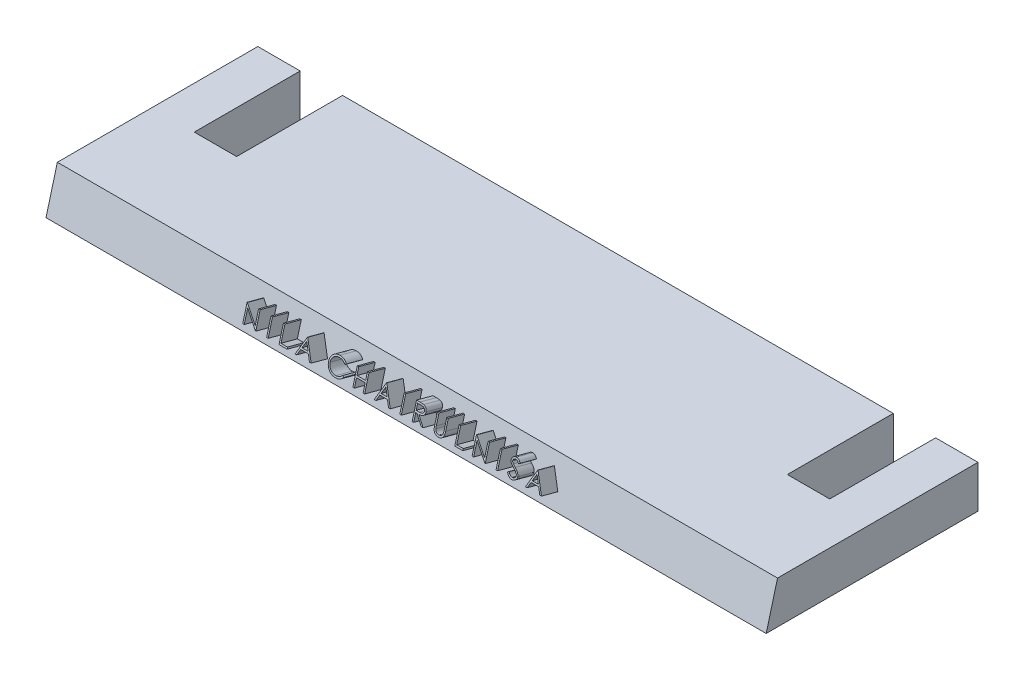
from build123d import *

# Parameters (mm, degrees)
BOSS_EXTRUDE1_DEPTH = 10
DRAFT1_ANGLE        = -15
SKETCH2_W           = 0.358974359
SKETCH2_H           = 4
BOSS_EXTRUDE2_DEPTH = 4


with BuildPart() as part:
    # Sketch1 → Boss-Extrude1 (new body)
    with BuildSketch(Plane(origin=(0, 0, 0), x_dir=(1, 0, 0), z_dir=(0, 1, 0))):
        Polygon((-75, 25), (-75, 0), (-65, 0), (-65, 25), (65, 25), (65, 0), (75, 0), (75, 25), (85, 25), (85, -25), (-85, -25), (-85, 25), align=None)
    extrude(amount=BOSS_EXTRUDE1_DEPTH)

    # Draft1
    draft1_faces = [part.faces().sort_by_distance(p)[0] for p in [
        (0, 5, 25),
    ]]
    draft(draft1_faces, Plane(origin=(0, 0, 0), x_dir=(0, 0, -1), z_dir=(0, -1, 0)), DRAFT1_ANGLE)

    # Sketch2 → Boss-Extrude2 (add)
    # profile 1 of 15: a face of its own
    with BuildSketch(Plane(origin=(0, 6.25, 23.325317547), x_dir=(1, 0, 0), z_dir=(0, 0.2588190451025213, 0.9659258262890681))):
        Polygon((-35.625650533, -2.888228707), (-35.625650533, 1.111771293), (-35.55033002, 1.111771293), (-32.907701815, -2.036465887), (-32.907701815, 1.111771293), (-32.548727456, 1.111771293), (-32.548727456, -2.888228707), (-32.630458225, -2.888228707), (-35.266676174, 0.252796934), (-35.266676174, -2.888228707), align=None)
    # profile 2 of 15: a face of its own
    with BuildSketch(Plane(origin=(0, 6.25, 23.325317547), x_dir=(1, 0, 0), z_dir=(0, 0.2588190451025213, 0.9659258262890681))):
        with Locations((-29.805137713, -0.888228707)):
            Rectangle(SKETCH2_W, SKETCH2_H)
    # profile 3 of 15: a face of its own
    with BuildSketch(Plane(origin=(0, 6.25, 23.325317547), x_dir=(1, 0, 0), z_dir=(0, 0.2588190451025213, 0.9659258262890681))):
        Polygon((-27.061547969, 1.111771293), (-26.70257361, 1.111771293), (-26.70257361, -2.477972297), (-25.164112072, -2.477972297), (-25.164112072, -2.888228707), (-27.061547969, -2.888228707), align=None)
    # profile 4 of 15: a face of its own
    with BuildSketch(Plane(origin=(0, 6.25, 23.325317547), x_dir=(1, 0, 0), z_dir=(0, 0.2588190451025213, 0.9659258262890681))):
        Polygon((-21.317958225, 1.111771293), (-19.471804379, -2.888228707), (-19.862028738, -2.888228707), (-20.453374892, -1.606177425), (-22.266676174, -1.606177425), (-22.874849251, -2.888228707), (-23.266676174, -2.888228707), (-21.369240277, 1.111771293), align=None)
        Polygon((-21.347605661, 0.332123857), (-22.071964636, -1.195921015), (-20.642477456, -1.195921015), align=None, mode=Mode.SUBTRACT)
    # profile 5 of 15: a face of its own
    with BuildSketch(Plane(origin=(0, 6.25, 23.325317547), x_dir=(1, 0, 0), z_dir=(0, 0.2588190451025213, 0.9659258262890681))):
        with BuildLine():
            Line((-11.984624892, 0.377796934), (-12.298727456, 0.137412319))
            add(Edge.make_bspline(
                [(-12.298727456, 0.137412319), (-12.321134186, 0.164116284), (-12.365645553, 0.217164188), (-12.437256071, 0.291655096), (-12.51188652, 0.361443966), (-12.589508372, 0.426863257), (-12.671518795, 0.485625275), (-12.755931136, 0.54079225), (-12.844157473, 0.590241093), (-12.966159456, 0.650198792), (-13.125756997, 0.712765826), (-13.326665384, 0.765226662), (-13.536392354, 0.798622291), (-13.679475325, 0.802239253), (-13.752253097, 0.804078985)],
                knots=[0, 0, 0, 0, 0.757959112, 1.505699292, 2.245454638, 2.979532153, 3.711538275, 4.438200793, 5.171680507, 5.909471876, 7.393775596, 8.890124382, 10.418191784, 12, 12, 12, 12], degree=3))
            add(Edge.make_bspline(
                [(-13.752253097, 0.804078985), (-13.792348296, 0.803617314), (-13.872166574, 0.802698256), (-13.990621972, 0.790573541), (-14.106865459, 0.773532158), (-14.22082142, 0.748246075), (-14.332344802, 0.716277367), (-14.44216469, 0.678076894), (-14.548691089, 0.63081422), (-14.653397647, 0.578576209), (-14.753716746, 0.519573415), (-14.8486368, 0.455215298), (-14.937811621, 0.386222045), (-15.021311749, 0.312335066), (-15.099222547, 0.233887111), (-15.170979474, 0.15004215), (-15.236334228, 0.061068237), (-15.296582257, -0.031861372), (-15.350539666, -0.128475991), (-15.395716671, -0.229133214), (-15.435722525, -0.332109332), (-15.467378803, -0.438567801), (-15.492435393, -0.547759534), (-15.509724151, -0.659977577), (-15.521710976, -0.774987497), (-15.522625463, -0.852940997), (-15.52308643, -0.892235117)],
                knots=[0, 0, 0, 0, 1.054917814, 2.100044995, 3.131103042, 4.146048494, 5.169673617, 6.183595914, 7.203665975, 8.234915748, 9.262203917, 10.264457458, 11.251630812, 12.227803204, 13.197192746, 14.159520551, 15.12972552, 16.100847026, 17.073214652, 18.039054194, 19.002613845, 19.979014051, 20.95965708, 21.949030935, 22.966165397, 24, 24, 24, 24], degree=3))
            add(Edge.make_bspline(
                [(-15.52308643, -0.892235117), (-15.521644352, -0.951356626), (-15.518813021, -1.067433866), (-15.493614925, -1.23745742), (-15.455323392, -1.400338191), (-15.397934161, -1.55505801), (-15.327169532, -1.703524705), (-15.23775169, -1.843226252), (-15.134189933, -1.976273754), (-15.015019168, -2.099522837), (-14.884269664, -2.212109952), (-14.743986337, -2.311253474), (-14.594518579, -2.393899054), (-14.437516716, -2.462671564), (-14.271772586, -2.515536396), (-14.09758424, -2.552752537), (-13.915330531, -2.577029315), (-13.790794074, -2.579353529), (-13.727413354, -2.580536399)],
                knots=[0, 0, 0, 0, 1.029171465, 2.020641659, 2.987623507, 3.938342917, 4.889210282, 5.84687017, 6.821220943, 7.821438502, 8.827599549, 9.822697543, 10.807740252, 11.797342354, 12.80366471, 13.83203677, 14.896651826, 16, 16, 16, 16], degree=3))
            add(Edge.make_bspline(
                [(-13.727413354, -2.580536399), (-13.657581709, -2.578606365), (-13.520136327, -2.574807597), (-13.318572869, -2.542625598), (-13.125617708, -2.49044512), (-12.941260466, -2.417418923), (-12.766020871, -2.322487166), (-12.599624687, -2.207403877), (-12.441931464, -2.071074354), (-12.347107141, -1.96697935), (-12.298727456, -1.913869733)],
                knots=[0, 0, 0, 0, 1.028121516, 2.023589091, 2.998037872, 3.967518031, 4.937445131, 5.927275754, 6.942489185, 8, 8, 8, 8], degree=3))
            Line((-12.298727456, -1.913869733), (-11.984624892, -2.151850502))
            add(Edge.make_bspline(
                [(-11.984624892, -2.151850502), (-12.009902732, -2.184465876), (-12.060337332, -2.249540397), (-12.142003637, -2.341279494), (-12.228034834, -2.42756982), (-12.319069932, -2.507715673), (-12.414061693, -2.583320776), (-12.514715765, -2.652237155), (-12.619708945, -2.715426737), (-12.728685492, -2.773286079), (-12.841529621, -2.824620076), (-12.958106118, -2.868567239), (-13.07791249, -2.906424256), (-13.200954214, -2.937569326), (-13.327486507, -2.961879136), (-13.457052763, -2.978130193), (-13.589932621, -2.98926381), (-13.679579959, -2.990278571), (-13.725009507, -2.99079281)],
                knots=[0, 0, 0, 0, 0.986787822, 1.968848986, 2.935600012, 3.899624008, 4.868462664, 5.837806735, 6.815139263, 7.798259679, 8.787526145, 9.778297419, 10.776456485, 11.791383307, 12.812564526, 13.85620153, 14.913611965, 16, 16, 16, 16], degree=3))
            add(Edge.make_bspline(
                [(-13.725009507, -2.99079281), (-13.768030841, -2.99049339), (-13.853100201, -2.989901323), (-13.978698775, -2.980310275), (-14.100972581, -2.967224861), (-14.219572154, -2.947521854), (-14.335144697, -2.92427118), (-14.446642507, -2.89310403), (-14.555162748, -2.858190696), (-14.660269423, -2.817156426), (-14.762051937, -2.770852217), (-14.860182007, -2.718519007), (-14.954614501, -2.660596876), (-15.046277839, -2.598362578), (-15.133817935, -2.529817091), (-15.217993393, -2.455912365), (-15.299276223, -2.376897496), (-15.349565005, -2.319920521), (-15.374849251, -2.291273579)],
                knots=[0, 0, 0, 0, 1.114604814, 2.203992996, 3.262667896, 4.300477797, 5.318619304, 6.316056647, 7.298880507, 8.271930387, 9.238335007, 10.195173496, 11.151986948, 12.108099108, 13.064862484, 14.031167946, 15.010108607, 16, 16, 16, 16], degree=3))
            add(Edge.make_bspline(
                [(-15.374849251, -2.291273579), (-15.415347129, -2.24151222), (-15.49585396, -2.142590265), (-15.598854741, -1.98226343), (-15.687023376, -1.814871191), (-15.758310142, -1.639534129), (-15.81403898, -1.456645687), (-15.85264606, -1.26611367), (-15.877733608, -1.068116022), (-15.88060251, -0.933445407), (-15.882060789, -0.864991528)],
                knots=[0, 0, 0, 0, 0.994628077, 1.977248131, 2.950237994, 3.925870899, 4.908910175, 5.911660606, 6.938484602, 8, 8, 8, 8], degree=3))
            add(Edge.make_bspline(
                [(-15.882060789, -0.864991528), (-15.880283425, -0.793042438), (-15.876786573, -0.651487095), (-15.847077092, -0.443745435), (-15.799284182, -0.244715264), (-15.731402024, -0.054768128), (-15.645338765, 0.12709505), (-15.539022635, 0.299484998), (-15.413688758, 0.463504198), (-15.270320109, 0.616663913), (-15.113100298, 0.756708888), (-14.944735939, 0.879915978), (-14.765556571, 0.982450282), (-14.577536169, 1.068160182), (-14.379266819, 1.134039568), (-14.17117154, 1.180157496), (-13.953641351, 1.208862772), (-13.805227151, 1.212491581), (-13.7298172, 1.214335396)],
                knots=[0, 0, 0, 0, 1.032925535, 2.032216505, 3.007276963, 3.968222605, 4.92396291, 5.891752235, 6.871517503, 7.883894988, 8.900124299, 9.891468569, 10.874487609, 11.85992873, 12.854644235, 13.869047385, 14.917252991, 16, 16, 16, 16], degree=3))
            add(Edge.make_bspline(
                [(-13.7298172, 1.214335396), (-13.683857803, 1.21378438), (-13.592885806, 1.212693702), (-13.458311346, 1.202058111), (-13.327291544, 1.184328275), (-13.199736136, 1.160195624), (-13.075024575, 1.130244399), (-12.954110014, 1.091226915), (-12.836282943, 1.046613737), (-12.722286477, 0.995232633), (-12.612667562, 0.937556357), (-12.507460341, 0.874224216), (-12.407500502, 0.805314724), (-12.312084676, 0.731413952), (-12.222809006, 0.650958456), (-12.137138745, 0.566161203), (-12.057983227, 0.47457969), (-12.009122433, 0.410116908), (-11.984624892, 0.377796934)],
                knots=[0, 0, 0, 0, 1.096760587, 2.17092713, 3.219439832, 4.250915756, 5.268269357, 6.278326846, 7.281116186, 8.274029601, 9.260640565, 10.235837813, 11.203064059, 12.156899882, 13.114053108, 14.069676657, 15.032185724, 16, 16, 16, 16], degree=3))
        make_face()
    # profile 6 of 15: a face of its own
    with BuildSketch(Plane(origin=(0, 6.25, 23.325317547), x_dir=(1, 0, 0), z_dir=(0, 0.2588190451025213, 0.9659258262890681))):
        Polygon((-9.625650533, 1.111771293), (-9.266676174, 1.111771293), (-9.266676174, -0.529254348), (-7.215394123, -0.529254348), (-7.215394123, 1.111771293), (-6.856419764, 1.111771293), (-6.856419764, -2.888228707), (-7.215394123, -2.888228707), (-7.215394123, -0.939510758), (-9.266676174, -0.939510758), (-9.266676174, -2.888228707), (-9.625650533, -2.888228707), align=None)
    # profile 7 of 15: a face of its own
    with BuildSketch(Plane(origin=(0, 6.25, 23.325317547), x_dir=(1, 0, 0), z_dir=(0, 0.2588190451025213, 0.9659258262890681))):
        Polygon((-2.651291559, 1.111771293), (-0.805137713, -2.888228707), (-1.195362072, -2.888228707), (-1.786708225, -1.606177425), (-3.600009507, -1.606177425), (-4.208182584, -2.888228707), (-4.600009507, -2.888228707), (-2.70257361, 1.111771293), align=None)
        Polygon((-2.680938995, 0.332123857), (-3.405297969, -1.195921015), (-1.975810789, -1.195921015), align=None, mode=Mode.SUBTRACT)
    # profile 8 of 15: a face of its own
    with BuildSketch(Plane(origin=(0, 6.25, 23.325317547), x_dir=(1, 0, 0), z_dir=(0, 0.2588190451025213, 0.9659258262890681))):
        with Locations((1.630759724, -0.888228707)):
            Rectangle(SKETCH2_W, SKETCH2_H)
    # profile 9 of 15: a face of its own
    with BuildSketch(Plane(origin=(0, 6.25, 23.325317547), x_dir=(1, 0, 0), z_dir=(0, 0.2588190451025213, 0.9659258262890681))):
        with BuildLine():
            Line((4.374349467, 1.111771293), (5.174830236, 1.111771293))
            add(Edge.make_bspline(
                [(5.174830236, 1.111771293), (5.228248669, 1.11159348), (5.330817977, 1.111252061), (5.477758857, 1.109348332), (5.611275539, 1.103891925), (5.731298213, 1.099196401), (5.837824676, 1.090634182), (5.931181579, 1.082450586), (6.010938948, 1.071737831), (6.059219921, 1.061788776), (6.081080236, 1.057284113)],
                knots=[0, 0, 0, 0, 1.410062039, 2.707475311, 3.878576406, 4.937260626, 5.877586885, 6.699081471, 7.410979367, 8, 8, 8, 8], degree=3))
            add(Edge.make_bspline(
                [(6.081080236, 1.057284113), (6.110344949, 1.050053525), (6.16825008, 1.035746595), (6.251621584, 1.005507051), (6.331066526, 0.970513194), (6.406254897, 0.929411799), (6.476810087, 0.881897766), (6.543459585, 0.82879134), (6.606505828, 0.770383105), (6.66339912, 0.705200429), (6.717043751, 0.636815846), (6.762287895, 0.562868696), (6.801289586, 0.485541236), (6.832341606, 0.404047044), (6.857345004, 0.319176447), (6.874974992, 0.23016068), (6.885547778, 0.13740528), (6.886624184, 0.074139098), (6.88716998, 0.042059755)],
                knots=[0, 0, 0, 0, 1.027469482, 2.033020251, 3.019912614, 3.986113645, 4.951240523, 5.91722682, 6.890402269, 7.87763091, 8.8651537, 9.85103654, 10.82876324, 11.815024772, 12.821070561, 13.842952187, 14.906261191, 16, 16, 16, 16], degree=3))
            add(Edge.make_bspline(
                [(6.88716998, 0.042059755), (6.885491125, -0.011237508), (6.882215244, -0.115234271), (6.851672268, -0.266160993), (6.80164196, -0.406948781), (6.732701058, -0.537420367), (6.644907372, -0.655032533), (6.539393325, -0.758335911), (6.416100054, -0.844781525), (6.301323693, -0.904727588), (6.199936037, -0.943119483), (6.116469393, -0.970132465), (6.025421419, -0.991003282), (5.927664465, -1.009700576), (5.822791716, -1.023816798), (5.711054528, -1.034155763), (5.592373212, -1.040617533), (5.510842847, -1.041579824), (5.468900749, -1.042074861)],
                knots=[0, 0, 0, 0, 1.260483769, 2.459530307, 3.627416485, 4.787058657, 5.939039949, 7.08810263, 8.267026773, 9.491475466, 10.141966685, 10.831826277, 11.566392101, 12.351337768, 13.187381173, 14.07005841, 15.007169909, 16, 16, 16, 16], degree=3))
            Line((5.468900749, -1.042074861), (6.938452031, -2.888228707))
            Line((6.938452031, -2.888228707), (6.494541775, -2.888228707))
            Line((6.494541775, -2.888228707), (5.024990493, -1.042074861))
            Line((5.024990493, -1.042074861), (4.733323826, -1.042074861))
            Line((4.733323826, -1.042074861), (4.733323826, -2.888228707))
            Line((4.733323826, -2.888228707), (4.374349467, -2.888228707))
            Line((4.374349467, -2.888228707), (4.374349467, 1.111771293))
        make_face()
        with BuildLine():
            Line((4.733323826, 0.701514883), (4.733323826, -0.631818451))
            Line((4.733323826, -0.631818451), (5.465695621, -0.637427425))
            add(Edge.make_bspline(
                [(5.465695621, -0.637427425), (5.499889951, -0.637442553), (5.566168302, -0.637471874), (5.662054776, -0.632907558), (5.751334904, -0.627715195), (5.833667192, -0.619773086), (5.909088421, -0.609537575), (5.977560893, -0.596734164), (6.039196381, -0.581817521), (6.111080425, -0.558729949), (6.191350746, -0.522151643), (6.278586701, -0.46893393), (6.352875087, -0.401997794), (6.415638358, -0.325456701), (6.466071994, -0.241300988), (6.501628627, -0.150539423), (6.524191418, -0.055463311), (6.526852613, 0.009883098), (6.528195621, 0.042861037)],
                knots=[0, 0, 0, 0, 1.146690395, 2.22261258, 3.21895312, 4.145990853, 4.996080663, 5.770904154, 6.481378293, 7.121626537, 8.300444488, 9.431385265, 10.535395872, 11.636531494, 12.74115979, 13.810798291, 14.895190096, 16, 16, 16, 16], degree=3))
            add(Edge.make_bspline(
                [(6.528195621, 0.042861037), (6.526821768, 0.075028549), (6.524099293, 0.138772822), (6.501872129, 0.232093863), (6.464284265, 0.320170377), (6.413630279, 0.402644074), (6.351916959, 0.477507772), (6.279553744, 0.541561661), (6.198519236, 0.594418192), (6.122780723, 0.628194627), (6.05508448, 0.648903031), (5.996307726, 0.66347579), (5.929894609, 0.675183754), (5.855522656, 0.684564395), (5.773509364, 0.692627189), (5.683440048, 0.698057793), (5.585912299, 0.701273637), (5.518315806, 0.701432596), (5.483323826, 0.701514883)],
                knots=[0, 0, 0, 0, 1.101028733, 2.181837193, 3.264309656, 4.369019818, 5.486613113, 6.575447106, 7.666700264, 8.788928104, 9.402425223, 10.0903467, 10.862060571, 11.710948788, 12.657782767, 13.684531032, 14.801375019, 16, 16, 16, 16], degree=3))
            Line((5.483323826, 0.701514883), (4.733323826, 0.701514883))
        make_face(mode=Mode.SUBTRACT)
    # profile 10 of 15: a face of its own
    with BuildSketch(Plane(origin=(0, 6.25, 23.325317547), x_dir=(1, 0, 0), z_dir=(0, 0.2588190451025213, 0.9659258262890681))):
        with BuildLine():
            Line((9.29742639, 1.111771293), (9.656400749, 1.111771293))
            Line((9.656400749, 1.111771293), (9.656400749, -1.284863322))
            add(Edge.make_bspline(
                [(9.656400749, -1.284863322), (9.656347327, -1.318784163), (9.65624595, -1.383154804), (9.656923109, -1.474775719), (9.65881953, -1.556229958), (9.660015141, -1.627831498), (9.662674951, -1.689251781), (9.664844147, -1.740823565), (9.667633355, -1.782302653), (9.670985489, -1.806509426), (9.67242639, -1.816914604)],
                knots=[0, 0, 0, 0, 1.528628734, 2.90083645, 4.128790002, 5.200304208, 6.127813768, 6.898992206, 7.526736466, 8, 8, 8, 8], degree=3))
            add(Edge.make_bspline(
                [(9.67242639, -1.816914604), (9.678343486, -1.854453763), (9.68984427, -1.927416882), (9.719154416, -2.031312061), (9.760088703, -2.124948013), (9.808595038, -2.211246632), (9.872518022, -2.2878059), (9.949093491, -2.358333503), (10.041868084, -2.420015566), (10.145023061, -2.476416494), (10.25620619, -2.521748016), (10.369819066, -2.556026147), (10.484153899, -2.576916318), (10.560698088, -2.57933522), (10.598708441, -2.580536399)],
                knots=[0, 0, 0, 0, 1.035780045, 2.013197591, 2.933192213, 3.817615948, 4.702609284, 5.640816605, 6.646850145, 7.73207398, 8.84249596, 9.914020372, 10.964143139, 12, 12, 12, 12], degree=3))
            add(Edge.make_bspline(
                [(10.598708441, -2.580536399), (10.631341287, -2.579309142), (10.696418501, -2.576861715), (10.793111565, -2.561705794), (10.887283117, -2.534390862), (10.97939818, -2.499145424), (11.065742162, -2.452576748), (11.146363239, -2.398781503), (11.218322021, -2.335683359), (11.283988304, -2.265854394), (11.341171088, -2.187066051), (11.390738107, -2.101033893), (11.431339169, -2.006463211), (11.451388912, -1.940001014), (11.461689211, -1.905856912)],
                knots=[0, 0, 0, 0, 0.994687771, 1.983630487, 2.973142513, 3.978332533, 4.983357753, 5.956394766, 6.925816176, 7.893390482, 8.871859704, 9.88551698, 10.913711441, 12, 12, 12, 12], degree=3))
            add(Edge.make_bspline(
                [(11.461689211, -1.905856912), (11.465117925, -1.891744256), (11.472758483, -1.86029557), (11.479897963, -1.807128381), (11.487333992, -1.744397679), (11.492493501, -1.67165275), (11.497523467, -1.589137353), (11.500532693, -1.49642163), (11.501923588, -1.393842246), (11.50233808, -1.322256919), (11.502554595, -1.284863322)],
                knots=[0, 0, 0, 0, 0.558680831, 1.244966039, 2.062412453, 2.990489873, 4.051219941, 5.244515665, 6.560634259, 8, 8, 8, 8], degree=3))
            Line((11.502554595, -1.284863322), (11.502554595, 1.111771293))
            Line((11.502554595, 1.111771293), (11.861528954, 1.111771293))
            Line((11.861528954, 1.111771293), (11.861528954, -1.304094092))
            add(Edge.make_bspline(
                [(11.861528954, -1.304094092), (11.861238531, -1.347635096), (11.860671752, -1.432608014), (11.855756808, -1.557123853), (11.847920236, -1.675241546), (11.836848136, -1.78697697), (11.822177275, -1.891930295), (11.805862737, -1.991021459), (11.785086128, -2.083539165), (11.760819384, -2.170204785), (11.733078186, -2.252702514), (11.697145445, -2.330998074), (11.656660302, -2.407471673), (11.608643556, -2.480966655), (11.55468769, -2.55180843), (11.493600055, -2.619567373), (11.427401014, -2.685326283), (11.354990089, -2.747398359), (11.277560917, -2.804322561), (11.195343823, -2.854377156), (11.108970372, -2.896689862), (11.018665085, -2.93151949), (10.924389424, -2.957707603), (10.826141013, -2.977222067), (10.723696221, -2.988310407), (10.654022328, -2.989958327), (10.618740493, -2.99079281)],
                knots=[0, 0, 0, 0, 1.316592851, 2.569410997, 3.76748051, 4.895814652, 5.963796859, 6.97159953, 7.931736103, 8.829262218, 9.692595152, 10.560224239, 11.431080259, 12.30701507, 13.211635791, 14.121146779, 15.063487852, 16.031507147, 17.00238618, 17.966455255, 18.938106653, 19.907068911, 20.888905087, 21.893141452, 22.933117798, 24, 24, 24, 24], degree=3))
            add(Edge.make_bspline(
                [(10.618740493, -2.99079281), (10.580261518, -2.989895935), (10.504765908, -2.98813627), (10.393522403, -2.978053127), (10.286877607, -2.959060677), (10.183705176, -2.934877884), (10.085409751, -2.901525041), (9.990674386, -2.862555756), (9.901121607, -2.81469603), (9.815298603, -2.761446438), (9.735498882, -2.701532565), (9.662244707, -2.636229509), (9.59541514, -2.566583364), (9.53613663, -2.491840089), (9.483427048, -2.412580995), (9.43802109, -2.328581864), (9.399034525, -2.239875217), (9.378912734, -2.178214416), (9.368740493, -2.14704281)],
                knots=[0, 0, 0, 0, 1.13879206, 2.234305948, 3.301075583, 4.341971843, 5.366689343, 6.369221514, 7.369726634, 8.367512178, 9.355451585, 10.318319045, 11.268648973, 12.207971039, 13.137398894, 14.081662264, 15.030215811, 16, 16, 16, 16], degree=3))
            add(Edge.make_bspline(
                [(9.368740493, -2.14704281), (9.36282374, -2.125748439), (9.349990173, -2.079560474), (9.336246976, -2.003118773), (9.32469374, -1.915101724), (9.313830245, -1.815503303), (9.307420007, -1.704246313), (9.301800077, -1.581378981), (9.297386798, -1.446752739), (9.297412824, -1.352976149), (9.29742639, -1.304094092)],
                knots=[0, 0, 0, 0, 0.625038921, 1.35572334, 2.194682327, 3.136881307, 4.189498639, 5.346923369, 6.617055217, 8, 8, 8, 8], degree=3))
            Line((9.29742639, -1.304094092), (9.29742639, 1.111771293))
        make_face()
    # profile 11 of 15: a face of its own
    with BuildSketch(Plane(origin=(0, 6.25, 23.325317547), x_dir=(1, 0, 0), z_dir=(0, 0.2588190451025213, 0.9659258262890681))):
        Polygon((14.425631518, 1.111771293), (14.784605877, 1.111771293), (14.784605877, -2.477972297), (16.323067416, -2.477972297), (16.323067416, -2.888228707), (14.425631518, -2.888228707), align=None)
    # profile 12 of 15: a face of its own
    with BuildSketch(Plane(origin=(0, 6.25, 23.325317547), x_dir=(1, 0, 0), z_dir=(0, 0.2588190451025213, 0.9659258262890681))):
        Polygon((18.528195621, -2.888228707), (18.528195621, 1.111771293), (18.603516134, 1.111771293), (21.246144339, -2.036465887), (21.246144339, 1.111771293), (21.605118698, 1.111771293), (21.605118698, -2.888228707), (21.523387928, -2.888228707), (18.88716998, 0.252796934), (18.88716998, -2.888228707), align=None)
    # profile 13 of 15: a face of its own
    with BuildSketch(Plane(origin=(0, 6.25, 23.325317547), x_dir=(1, 0, 0), z_dir=(0, 0.2588190451025213, 0.9659258262890681))):
        with Locations((24.348708442, -0.888228707)):
            Rectangle(SKETCH2_W, SKETCH2_H)
    # profile 14 of 15: a face of its own
    with BuildSketch(Plane(origin=(0, 6.25, 23.325317547), x_dir=(1, 0, 0), z_dir=(0, 0.2588190451025213, 0.9659258262890681))):
        with BuildLine():
            Line((26.682041775, -2.116594092), (27.0201828, -1.913869733))
            add(Edge.make_bspline(
                [(27.0201828, -1.913869733), (27.051632214, -1.966514744), (27.111888078, -2.067380554), (27.212403917, -2.203675458), (27.316555815, -2.319517922), (27.425115054, -2.414234045), (27.537418994, -2.488804202), (27.65420077, -2.541606752), (27.775066839, -2.574539295), (27.857322635, -2.578539394), (27.898387928, -2.580536399)],
                knots=[0, 0, 0, 0, 1.272034388, 2.437168799, 3.508375237, 4.49857839, 5.41946034, 6.295179144, 7.148887113, 8, 8, 8, 8], degree=3))
            add(Edge.make_bspline(
                [(27.898387928, -2.580536399), (27.933458626, -2.579559631), (28.002986367, -2.577623185), (28.105343216, -2.559016554), (28.20475099, -2.530431264), (28.299160862, -2.489493056), (28.387270135, -2.439963358), (28.46453493, -2.380139155), (28.531330488, -2.313160635), (28.585969476, -2.238437601), (28.627889516, -2.158075145), (28.660109023, -2.075588344), (28.677989107, -1.989681408), (28.68068254, -1.931840879), (28.682041775, -1.902651784)],
                knots=[0, 0, 0, 0, 1.095163259, 2.171163733, 3.241058638, 4.321873601, 5.38011039, 6.391990106, 7.366004449, 8.327778327, 9.272591725, 10.192022065, 11.087607919, 12, 12, 12, 12], degree=3))
            add(Edge.make_bspline(
                [(28.682041775, -1.902651784), (28.680356848, -1.869347956), (28.676931639, -1.80164614), (28.647981376, -1.701760822), (28.602439379, -1.60291217), (28.560424929, -1.541767867), (28.538612287, -1.510023579)],
                knots=[0, 0, 0, 0, 0.938893495, 1.908633276, 2.914225137, 4, 4, 4, 4], degree=3))
            add(Edge.make_bspline(
                [(28.538612287, -1.510023579), (28.520703014, -1.487112923), (28.483104735, -1.439014868), (28.418467578, -1.367420313), (28.34262059, -1.293570691), (28.258159384, -1.214646055), (28.162007283, -1.134317144), (28.057175838, -1.048753398), (27.94098857, -0.961208739), (27.859503431, -0.902497235), (27.817458441, -0.872203066)],
                knots=[0, 0, 0, 0, 0.722233717, 1.516239348, 2.393582979, 3.351407094, 4.387010283, 5.505090956, 6.712668013, 8, 8, 8, 8], degree=3))
            add(Edge.make_bspline(
                [(27.817458441, -0.872203066), (27.775373874, -0.842227537), (27.694911387, -0.784916609), (27.582387293, -0.699860284), (27.481765049, -0.622095862), (27.393491887, -0.550891277), (27.317606634, -0.486236871), (27.253511307, -0.428753512), (27.20283867, -0.376886586), (27.174660864, -0.343239338), (27.162009723, -0.328132553)],
                knots=[0, 0, 0, 0, 1.452282411, 2.77665338, 3.964542531, 5.026858415, 5.96415736, 6.766646006, 7.446254459, 8, 8, 8, 8], degree=3))
            add(Edge.make_bspline(
                [(27.162009723, -0.328132553), (27.144326815, -0.304588511), (27.109551001, -0.258285992), (27.063646995, -0.185914726), (27.024630809, -0.111830995), (26.994045286, -0.035835721), (26.968289608, 0.041004198), (26.950966258, 0.119691336), (26.940118948, 0.199872614), (26.939008106, 0.253830901), (26.938452031, 0.280841806)],
                knots=[0, 0, 0, 0, 1.068054152, 2.10047183, 3.106115577, 4.101338837, 5.06977816, 6.043150881, 7.020423561, 8, 8, 8, 8], degree=3))
            add(Edge.make_bspline(
                [(26.938452031, 0.280841806), (26.939943698, 0.323161548), (26.94289515, 0.406896478), (26.967855741, 0.529217427), (27.007253334, 0.646001904), (27.062447491, 0.756093714), (27.133598752, 0.856626264), (27.215937008, 0.948755963), (27.314007278, 1.026205771), (27.421610276, 1.093876695), (27.539388987, 1.146843467), (27.662807163, 1.186798873), (27.792060959, 1.209438024), (27.879607399, 1.212686899), (27.924028954, 1.214335396)],
                knots=[0, 0, 0, 0, 1.005424448, 1.989358655, 2.955360095, 3.929531133, 4.905563448, 5.876582895, 6.856512386, 7.866279853, 8.892233794, 9.918561126, 10.94386622, 12, 12, 12, 12], degree=3))
            add(Edge.make_bspline(
                [(27.924028954, 1.214335396), (27.971165069, 1.212709622), (28.064903756, 1.209476478), (28.202788574, 1.181365014), (28.335543679, 1.13484996), (28.442335981, 1.082062923), (28.52591628, 1.029341305), (28.589656546, 0.981318648), (28.654247918, 0.92603281), (28.72021141, 0.863336529), (28.786429306, 0.792654527), (28.85388468, 0.714470883), (28.922735273, 0.629263391), (28.967027685, 0.56843539), (28.989734082, 0.537252062)],
                knots=[0, 0, 0, 0, 1.286793592, 2.559021753, 3.825965368, 5.121522368, 5.803751409, 6.523245864, 7.299691795, 8.125521123, 9.008227632, 9.944561021, 10.946284179, 12, 12, 12, 12], degree=3))
            Line((28.989734082, 0.537252062), (28.665214852, 0.291258472))
            add(Edge.make_bspline(
                [(28.665214852, 0.291258472), (28.6456195, 0.31650269), (28.607883435, 0.365117151), (28.550592593, 0.433198654), (28.496594138, 0.495388917), (28.443393681, 0.549406206), (28.393800959, 0.598208644), (28.345667197, 0.639991223), (28.299685081, 0.675163332), (28.241722898, 0.712698829), (28.168902648, 0.749906262), (28.07749175, 0.781390923), (27.981964578, 0.800310994), (27.916902142, 0.802812579), (27.883964852, 0.804078985)],
                knots=[0, 0, 0, 0, 1.181633172, 2.275549214, 3.290209073, 4.226197932, 5.078386478, 5.862611352, 6.581680152, 7.217281963, 8.414376989, 9.595101626, 10.782541182, 12, 12, 12, 12], degree=3))
            add(Edge.make_bspline(
                [(27.883964852, 0.804078985), (27.842643112, 0.802694185), (27.762958029, 0.800023729), (27.64982633, 0.770858032), (27.548004702, 0.724935906), (27.460516056, 0.660575931), (27.387673797, 0.584323368), (27.334981844, 0.496576105), (27.30326737, 0.39968193), (27.299397336, 0.332091466), (27.29742639, 0.297668729)],
                knots=[0, 0, 0, 0, 1.14458467, 2.207223713, 3.21896685, 4.227309161, 5.202851033, 6.127160689, 7.046193047, 8, 8, 8, 8], degree=3))
            add(Edge.make_bspline(
                [(27.29742639, 0.297668729), (27.297875678, 0.276238468), (27.298774987, 0.233342903), (27.311317613, 0.169969849), (27.327431132, 0.10675689), (27.352965568, 0.043988224), (27.388217344, -0.019433901), (27.434508974, -0.084601601), (27.492809902, -0.152089268), (27.537469344, -0.19598341), (27.561048185, -0.219158194)],
                knots=[0, 0, 0, 0, 0.858281714, 1.717966888, 2.583508476, 3.4729293, 4.427298488, 5.488583878, 6.674047936, 8, 8, 8, 8], degree=3))
            add(Edge.make_bspline(
                [(27.561048185, -0.219158194), (27.569804039, -0.226971938), (27.590605944, -0.245535605), (27.628635574, -0.275926783), (27.678855915, -0.313415665), (27.739955573, -0.35980117), (27.813061129, -0.413608555), (27.898180622, -0.474149826), (27.994365231, -0.543390351), (28.062618849, -0.591798968), (28.098708441, -0.617395374)],
                knots=[0, 0, 0, 0, 0.420754252, 0.999615792, 1.744751191, 2.668019286, 3.750313428, 4.999500688, 6.413464383, 8, 8, 8, 8], degree=3))
            add(Edge.make_bspline(
                [(28.098708441, -0.617395374), (28.142120914, -0.648985499), (28.22618315, -0.710155398), (28.345791812, -0.802059032), (28.454241879, -0.891942196), (28.551914111, -0.97923089), (28.639773435, -1.063262997), (28.716845116, -1.145049488), (28.783914465, -1.224004429), (28.856119286, -1.325230229), (28.929899651, -1.449551469), (28.993261374, -1.601869455), (29.033213771, -1.754779536), (29.03843836, -1.857553063), (29.041016134, -1.908260758)],
                knots=[0, 0, 0, 0, 1.163667725, 2.253281268, 3.268753668, 4.215851969, 5.092017293, 5.902905408, 6.650798638, 7.335211899, 8.59617414, 9.77448103, 10.901945474, 12, 12, 12, 12], degree=3))
            add(Edge.make_bspline(
                [(29.041016134, -1.908260758), (29.040265119, -1.944121747), (29.038777673, -2.015147328), (29.021679486, -2.119438845), (28.99662844, -2.220731267), (28.958871601, -2.317772538), (28.912787991, -2.412337982), (28.85431228, -2.501947011), (28.786532069, -2.588582895), (28.708779194, -2.669935456), (28.623698163, -2.744616823), (28.533773941, -2.811050036), (28.438859343, -2.866442406), (28.339469267, -2.911643368), (28.235580882, -2.94699596), (28.127229129, -2.972610667), (28.014235402, -2.98833148), (27.937434852, -2.989963207), (27.898387928, -2.99079281)],
                knots=[0, 0, 0, 0, 0.983748083, 1.948392443, 2.894712957, 3.844097841, 4.80183111, 5.778335162, 6.776009319, 7.81870978, 8.863265674, 9.881300176, 10.883814829, 11.87499822, 12.874611388, 13.892143829, 14.928324115, 16, 16, 16, 16], degree=3))
            add(Edge.make_bspline(
                [(27.898387928, -2.99079281), (27.868176108, -2.990208602), (27.808132954, -2.989047544), (27.719322117, -2.978783224), (27.632305444, -2.96426082), (27.548174836, -2.94120474), (27.465846365, -2.913231052), (27.385678097, -2.878787243), (27.307631179, -2.837510442), (27.231268227, -2.790316128), (27.156783456, -2.735392991), (27.084875492, -2.671423281), (27.013184995, -2.600171275), (26.94382797, -2.51970206), (26.87540152, -2.431315679), (26.809254766, -2.334185184), (26.744018517, -2.228839637), (26.703086554, -2.15470811), (26.682041775, -2.116594092)],
                knots=[0, 0, 0, 0, 0.915332311, 1.819136955, 2.706846663, 3.586547465, 4.459518054, 5.340707479, 6.227863349, 7.133153174, 8.059268498, 9.028702269, 10.047606654, 11.120612155, 12.245963614, 13.433783089, 14.680604001, 16, 16, 16, 16], degree=3))
        make_face()
    # profile 15 of 15: a face of its own
    with BuildSketch(Plane(origin=(0, 6.25, 23.325317547), x_dir=(1, 0, 0), z_dir=(0, 0.2588190451025213, 0.9659258262890681))):
        Polygon((33.041016134, 1.111771293), (34.88716998, -2.888228707), (34.496945621, -2.888228707), (33.905599467, -1.606177425), (32.092298185, -1.606177425), (31.484125108, -2.888228707), (31.092298185, -2.888228707), (32.989734082, 1.111771293), align=None)
        Polygon((33.011368698, 0.332123857), (32.287009723, -1.195921015), (33.716496903, -1.195921015), align=None, mode=Mode.SUBTRACT)
    extrude(amount=BOSS_EXTRUDE2_DEPTH)


solid = part.part
